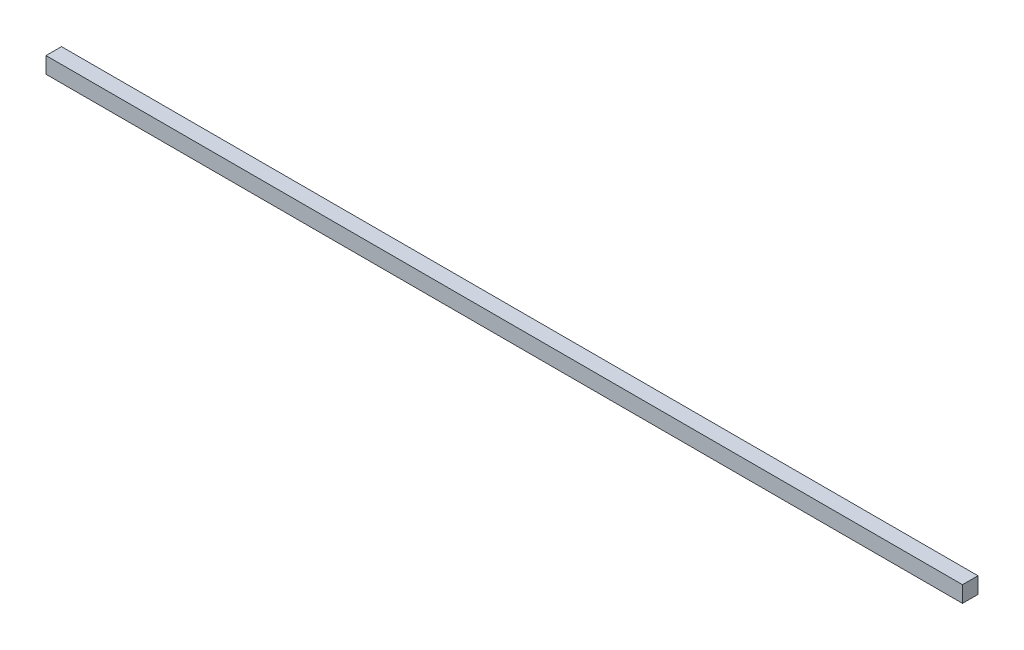
from build123d import *

# Parameters (mm, degrees)
SKETCH_1_W      = 1300
SKETCH_1_H      = 23
EXTRUDE_1_DEPTH = 22


with BuildPart() as part:
    # 草图1 → 凸台-拉伸1 (new body)
    with BuildSketch(Plane.XY):
        with Locations((602.961290323, -6.974193548)):
            Rectangle(SKETCH_1_W, SKETCH_1_H)
    extrude(amount=EXTRUDE_1_DEPTH)


solid = part.part
